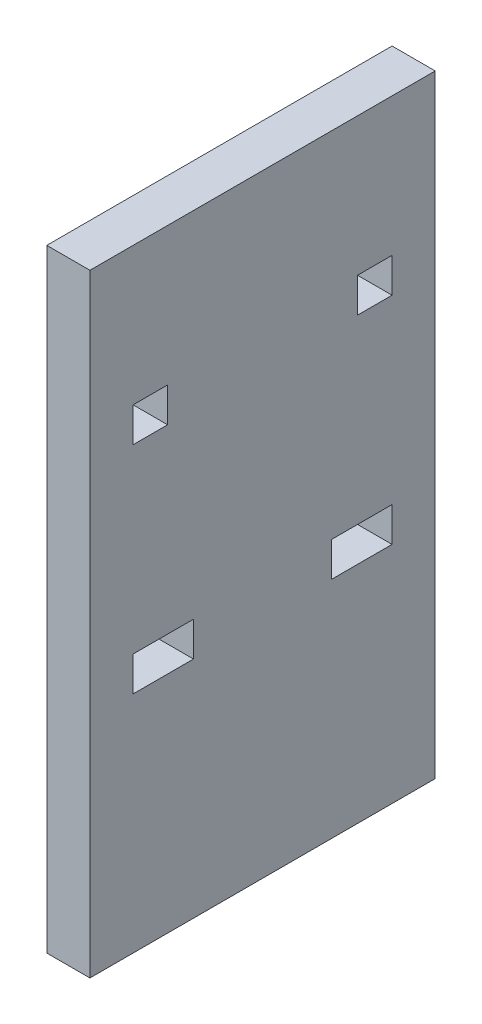
from build123d import *

# Parameters (mm, degrees)
SKETCH1_W           = 5
SKETCH1_H           = 40
BOSS_EXTRUDE1_DEPTH = 71
SKETCH2_W           = 7
SKETCH2_H           = 4
SKETCH2_W_2         = 4
CUT_EXTRUDE1_DEPTH  = 10


with BuildPart() as part:
    # Sketch1 → Boss-Extrude1 (new body)
    with BuildSketch(Plane(origin=(0, 0, 0), x_dir=(1, 0, 0), z_dir=(0, 1, 0))):
        Rectangle(SKETCH1_W, SKETCH1_H)
    extrude(amount=BOSS_EXTRUDE1_DEPTH)

    # Sketch2 → Cut-Extrude1 (cut)
    with BuildSketch(Plane(origin=(2.5, 0, 0), x_dir=(0, 0, -1), z_dir=(1, 0, 0))):
        with Locations((-11.5, 28)):
            Rectangle(SKETCH2_W, SKETCH2_H)
        with Locations((11.5, 28)):
            Rectangle(SKETCH2_W, SKETCH2_H)
        with Locations((-13, 53)):
            Rectangle(SKETCH2_W_2, SKETCH2_H)
        with Locations((13, 53)):
            Rectangle(SKETCH2_W_2, SKETCH2_H)
    extrude(amount=-CUT_EXTRUDE1_DEPTH, mode=Mode.SUBTRACT)


solid = part.part
